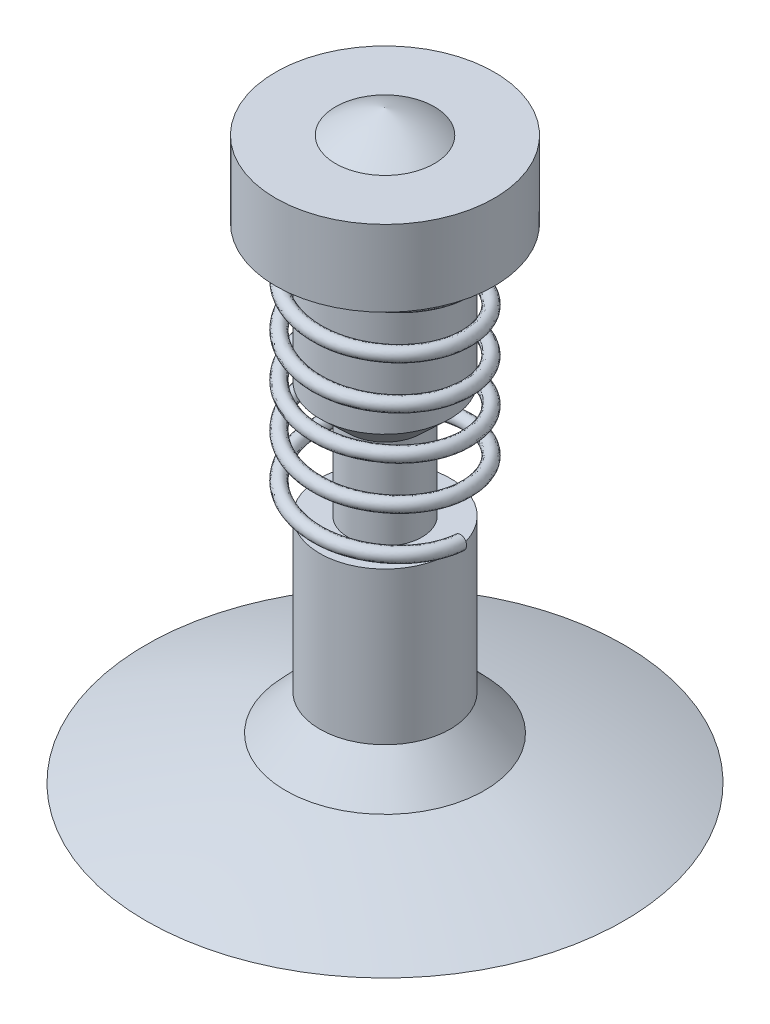
from build123d import *

# Parameters (mm, degrees)
SWEEP1_PITCH       = 0.2
SWEEP1_HEIGHT      = 1.1
SWEEP1_RADIUS      = 0.345
SWEEP1_START_ANGLE = -90
SWEEP1_PROFILE_R   = 0.03


with BuildPart() as part:
    # Sketch1 → Revolve1 (revolve)
    with BuildSketch(Plane.XY, mode=Mode.PRIVATE) as revolve1_sk:
        with BuildLine():
            Line((0, 2.69), (0, 0))
            Line((0, 0), (1.1, 0))
            ThreePointArc((1.1, 0), (0.782266525, 0.110633319), (0.45726344, 0.197623474))
            Line((0.45726344, 0.197623474), (0.3, 0.363768019))
            Line((0.3, 0.363768019), (0.3, 1.063910605))
            Line((0.3, 1.063910605), (0.17, 1.063910605))
            Line((0.17, 1.063910605), (0.17, 1.477852653))
            Line((0.17, 1.477852653), (0.3, 1.600903621))
            Line((0.3, 1.600903621), (0.3, 2.230903621))
            Line((0.3, 2.230903621), (0.50301008, 2.230903621))
            Line((0.50301008, 2.230903621), (0.50301008, 2.580903621))
            Line((0.50301008, 2.580903621), (0.227127084, 2.580903621))
            ThreePointArc((0.227127084, 2.580903621), (0.118507885, 2.645745407), (0, 2.69))
        make_face()
    revolve(revolve1_sk.sketch.rotate(Axis((0, 2.69, 0), (0, -1, 0)), 90), axis=Axis((0, 2.69, 0), (0, -1, 0)))

    # Sweep1: sweep along a helix
    with BuildLine() as sweep1_path:
        add(Helix(SWEEP1_PITCH, SWEEP1_HEIGHT, SWEEP1_RADIUS, center=(0, 2.230903621, 0), direction=(0, -1, 0), lefthand=True, mode=Mode.PRIVATE).rotate(Axis((0, 2.230903621, 0), (0, -1, 0)), SWEEP1_START_ANGLE))
    # Sweep1 profile (on start of the path) → Sweep1 (sweep)
    with BuildSketch(Plane(origin=(-0.345, 2.230903621, 0), x_dir=(0, 0.9957706843610612, 0.0918735226662387), z_dir=(-1.511571377657166e-13, -0.0918735226662387, 0.9957706843610612))):
        Circle(SWEEP1_PROFILE_R)
    sweep(path=sweep1_path.line, is_frenet=True)


solid = part.part
